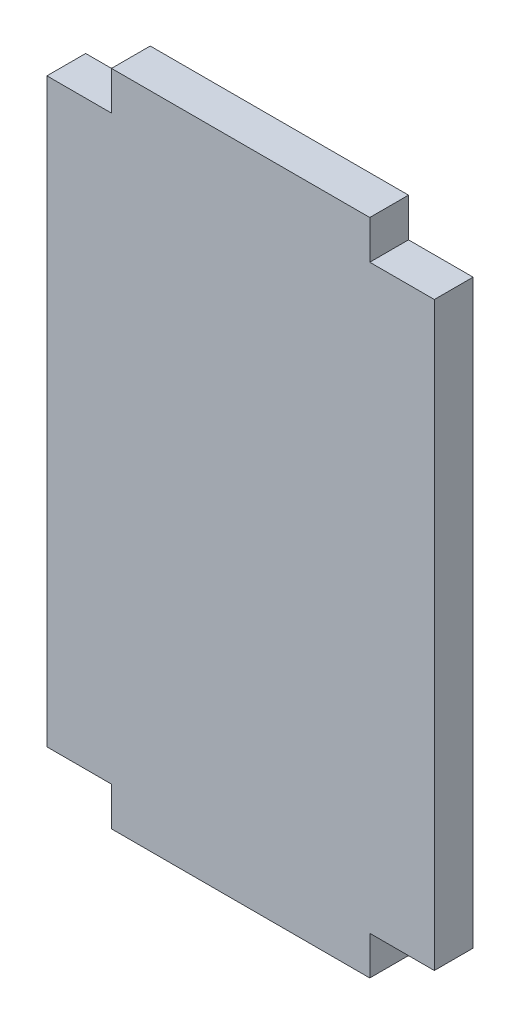
from build123d import *

# Parameters (mm, degrees)
BOSS_EXTRUDE1_DEPTH = 3


with BuildPart() as part:
    # Sketch1 → Boss-Extrude1 (new body)
    with BuildSketch(Plane.XY):
        Polygon((-10, 25.5), (10, 25.5), (10, 22.5), (15, 22.5), (15, -22.5), (10, -22.5), (10, -25.5), (-10, -25.5), (-10, -22.5), (-15, -22.5), (-15, 22.5), (-10, 22.5), align=None)
    extrude(amount=BOSS_EXTRUDE1_DEPTH)


solid = part.part
